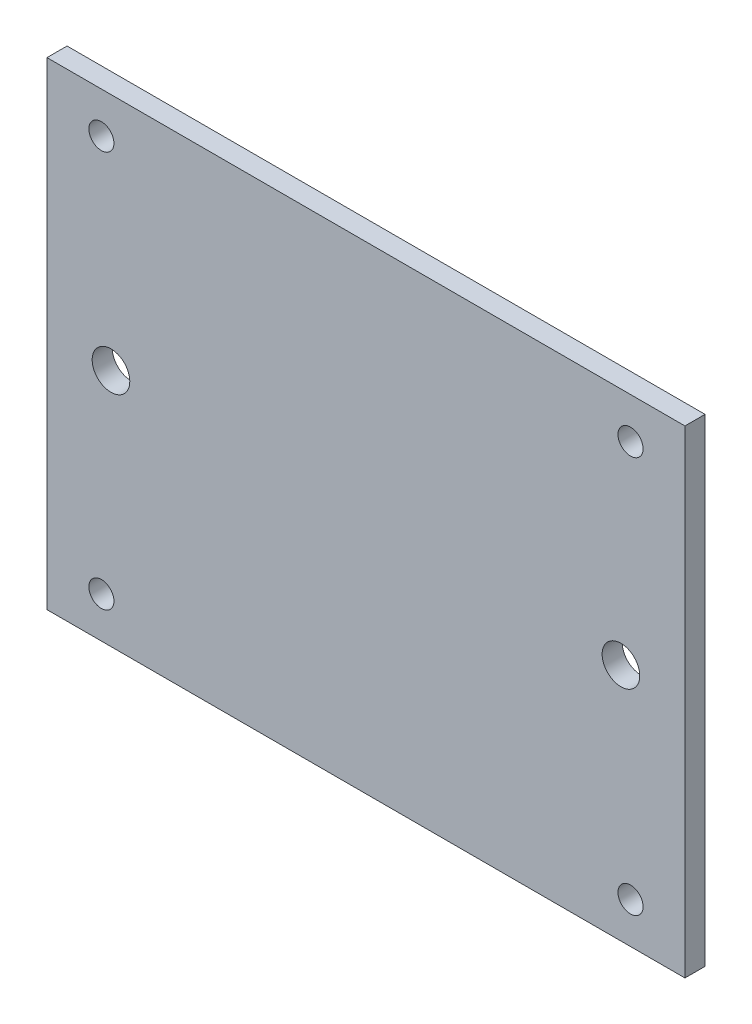
from build123d import *

# Parameters (mm, degrees)
SKETCH1_W           = 50.84
SKETCH1_H           = 38.1
SKETCH1_R           = 1
SKETCH1_R_2         = 1.5
BOSS_EXTRUDE1_DEPTH = 1.6


with BuildPart() as part:
    # Sketch1 → Boss-Extrude1 (new body)
    with BuildSketch(Plane.XY):
        Rectangle(SKETCH1_W, SKETCH1_H)
        with Locations((-21.083254593, 15.8)):
            Circle(SKETCH1_R, mode=Mode.SUBTRACT)
        with Locations(Location((21.083254593, 15.8, 0), (0, 0, 180))):
            Circle(SKETCH1_R, mode=Mode.SUBTRACT)
        with Locations((21.083254593, -15.8)):
            Circle(SKETCH1_R, mode=Mode.SUBTRACT)
        with Locations(Location((-21.083254593, -15.8, 0), (0, 0, 180))):
            Circle(SKETCH1_R, mode=Mode.SUBTRACT)
        with Locations((-20.32, 0)):
            Circle(SKETCH1_R_2, mode=Mode.SUBTRACT)
        with Locations(Location((20.32, 0, 0), (0, 0, 180))):
            Circle(SKETCH1_R_2, mode=Mode.SUBTRACT)
    extrude(amount=BOSS_EXTRUDE1_DEPTH)


solid = part.part
